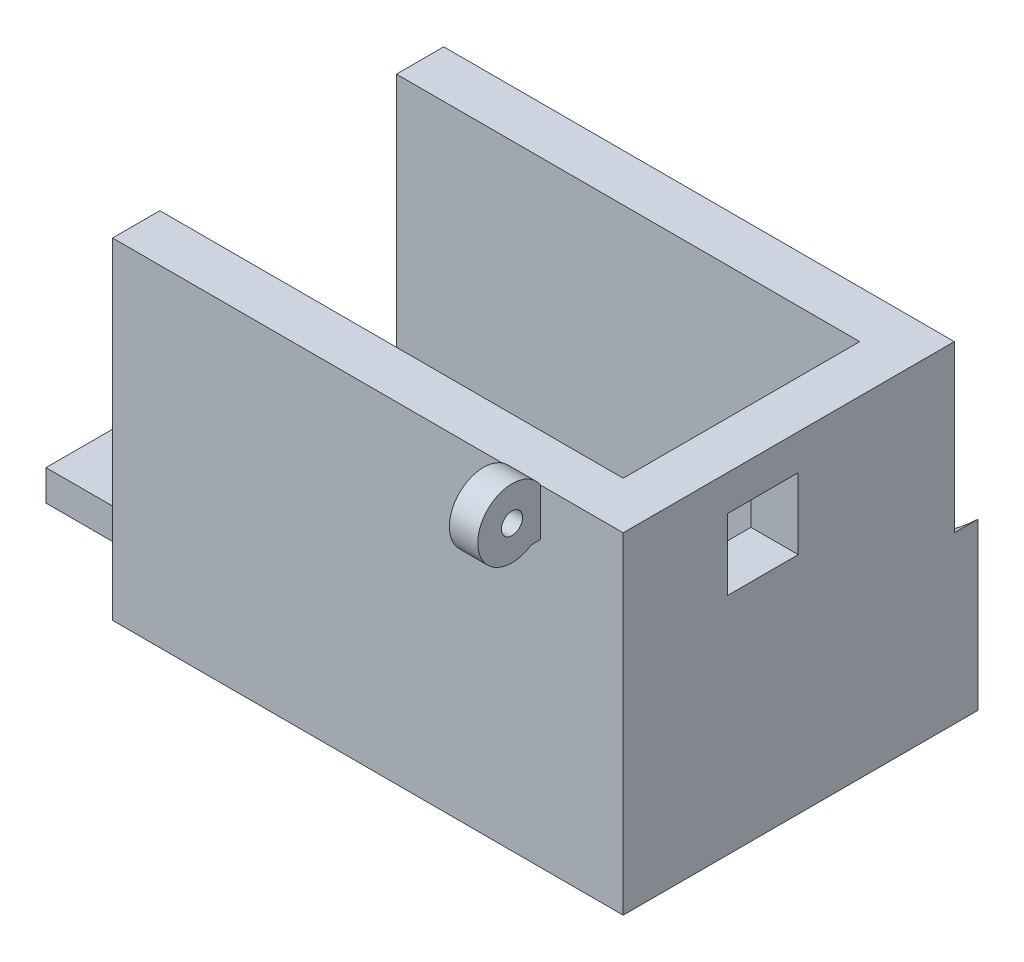
from build123d import *

# Parameters (mm, degrees)
SKETCH_1_W           = 365.88
SKETCH_1_H           = 140
EXTRUDE_1_DEPTH      = 140
SKETCH_2_W           = 345.88
SKETCH_2_H           = 100
CUT_EXTRUDE_1_DEPTH  = 110
SKETCH_8_W           = 12
SKETCH_8_H           = 12
EXTRUDE_2_DEPTH      = 10
SKETCH_9_R           = 14.49
SKETCH_9_R_2         = 4.49
EXTRUDE_1_2_DEPTH    = 12
SKETCH_11_R          = 4.49
CUT_EXTRUDE_5_DEPTH  = 377.473106042
SKETCH_13_W          = 150
SKETCH_13_H          = 140
CUT_EXTRUDE_7_DEPTH  = 268.84258315
SKETCH_14_W          = 98.139384751
SKETCH_14_H          = 13
EXTRUDE_3_DEPTH      = 50
SKETCH_15_R          = 3
CUT_EXTRUDE_8_DEPTH  = 231.670688982
EXTRUDE_4_DEPTH      = 10
SKETCH_22_W          = 30
SKETCH_22_H          = 45
CUT_EXTRUDE_9_DEPTH  = 305.478898404
SKETCH_26_W          = 20
SKETCH_26_H          = 15
EXTRUDE_6_DEPTH      = 40
SKETCH_30_R          = 3
CUT_EXTRUDE_10_DEPTH = 231.670689053


with BuildPart() as part:
    # 草圖1 → Extrude 1 (new body)
    with BuildSketch(Plane(origin=(0, 0, 0), x_dir=(1, 0, 0), z_dir=(0, 1, 0))):
        with Locations((-20.403414634, -7.390243902)):
            Rectangle(SKETCH_1_W, SKETCH_1_H)
    extrude(amount=EXTRUDE_1_DEPTH)

    # 草圖2 → 除料-伸長1 (cut)
    with BuildSketch(Plane(origin=(0, 140, 0), x_dir=(1, 0, 0), z_dir=(0, 1, 0))):
        with Locations((-30.403414634, -7.390243902)):
            Rectangle(SKETCH_2_W, SKETCH_2_H)
    extrude(amount=-CUT_EXTRUDE_1_DEPTH, mode=Mode.SUBTRACT)

    # 草圖8 → 填料-伸長2 (add)
    with BuildSketch(Plane.XY.offset(77.390243902)):
        with Locations((121.536585366, 126)):
            Rectangle(SKETCH_8_W, SKETCH_8_H)
    extrude(amount=EXTRUDE_2_DEPTH)

    # 草圖9 → Extrude 1 2 (add)
    with BuildSketch(Plane(origin=(127.536585366, 0, 0), x_dir=(0, 0, -1), z_dir=(1, 0, 0))):
        with Locations((-89.390243902, 132)):
            Circle(SKETCH_9_R)
        with Locations((-89.390243902, 132)):
            Circle(SKETCH_9_R_2, mode=Mode.SUBTRACT)
    extrude(amount=-EXTRUDE_1_2_DEPTH)

    # 草圖11 → 除料-伸長5 (cut, through all)
    with BuildSketch(Plane(origin=(127.536585366, 0, 0), x_dir=(0, 0, -1), z_dir=(1, 0, 0))):
        with Locations((-89.390243902, 132)):
            Circle(SKETCH_11_R)
    extrude(amount=-CUT_EXTRUDE_5_DEPTH, mode=Mode.SUBTRACT)

    # 草圖13 → 除料-伸長7 (cut, through all)
    with BuildSketch(Plane(origin=(0, 140, 0), x_dir=(1, 0, 0), z_dir=(0, 1, 0))):
        with Locations((-128.343414634, -7.390243902)):
            Rectangle(SKETCH_13_W, SKETCH_13_H)
    extrude(amount=-CUT_EXTRUDE_7_DEPTH, mode=Mode.SUBTRACT)

    # 草圖14 → 填料-伸長3 (add)
    with BuildSketch(Plane.ZY.offset(53.343414634)):
        with Locations((6.459936277, 13.5)):
            Rectangle(SKETCH_14_W, SKETCH_14_H)
    extrude(amount=EXTRUDE_3_DEPTH)

    # 草圖15 → 除料-伸長8 (cut, through all)
    with BuildSketch(Plane(origin=(0, 20, 0), x_dir=(1, 0, 0), z_dir=(0, 1, 0))):
        with Locations(Location((10.536585366, -7.390243902, 0), (0, 0, 270))):
            Circle(SKETCH_15_R)
    extrude(amount=-CUT_EXTRUDE_8_DEPTH, mode=Mode.SUBTRACT)

    # 草圖16 → 填料-伸長4 (add)
    with BuildSketch(Plane(origin=(0, 0, -62.609756098), x_dir=(-1, 0, 0), z_dir=(0, 0, -1))):
        with BuildLine():
            Line((-162.536585366, 70), (-162.536585366, 0))
            Line((-162.536585366, 0), (53.343414634, 0))
            Line((53.343414634, 0), (53.343414634, 82.32))
            add(Edge.make_bspline(
                [(53.343414634, 82.32), (-56.153144995, 198.160876335), (-74.64229081, -13.821841175), (-162.536585366, 70)],
                knots=[0, 0, 0, 0, 1, 1, 1, 1], degree=3))
        make_face()
    extrude(amount=EXTRUDE_4_DEPTH)

    # 草圖22 → 除料-伸長9 (cut, through all)
    with BuildSketch(Plane.ZY.offset(-142.536585366)):
        with Locations((18.390243902, 117.5)):
            Rectangle(SKETCH_22_W, SKETCH_22_H)
    extrude(amount=-CUT_EXTRUDE_9_DEPTH, mode=Mode.SUBTRACT)

    # 草圖26 → 填料-伸長6 (add)
    with BuildSketch(Plane.XY.offset(3.390243902)):
        with Locations((152.536585366, 132.5)):
            Rectangle(SKETCH_26_W, SKETCH_26_H)
    extrude(amount=EXTRUDE_6_DEPTH)

    # 草圖30 → 除料-伸長10 (cut, through all)
    with BuildSketch(Plane(origin=(0, 20, 0), x_dir=(1, 0, 0), z_dir=(0, 1, 0))):
        with Locations(Location((-83.343414634, -7.390243902, 0), (0, 0, 270))):
            Circle(SKETCH_30_R)
    extrude(amount=-CUT_EXTRUDE_10_DEPTH, mode=Mode.SUBTRACT)


solid = part.part
